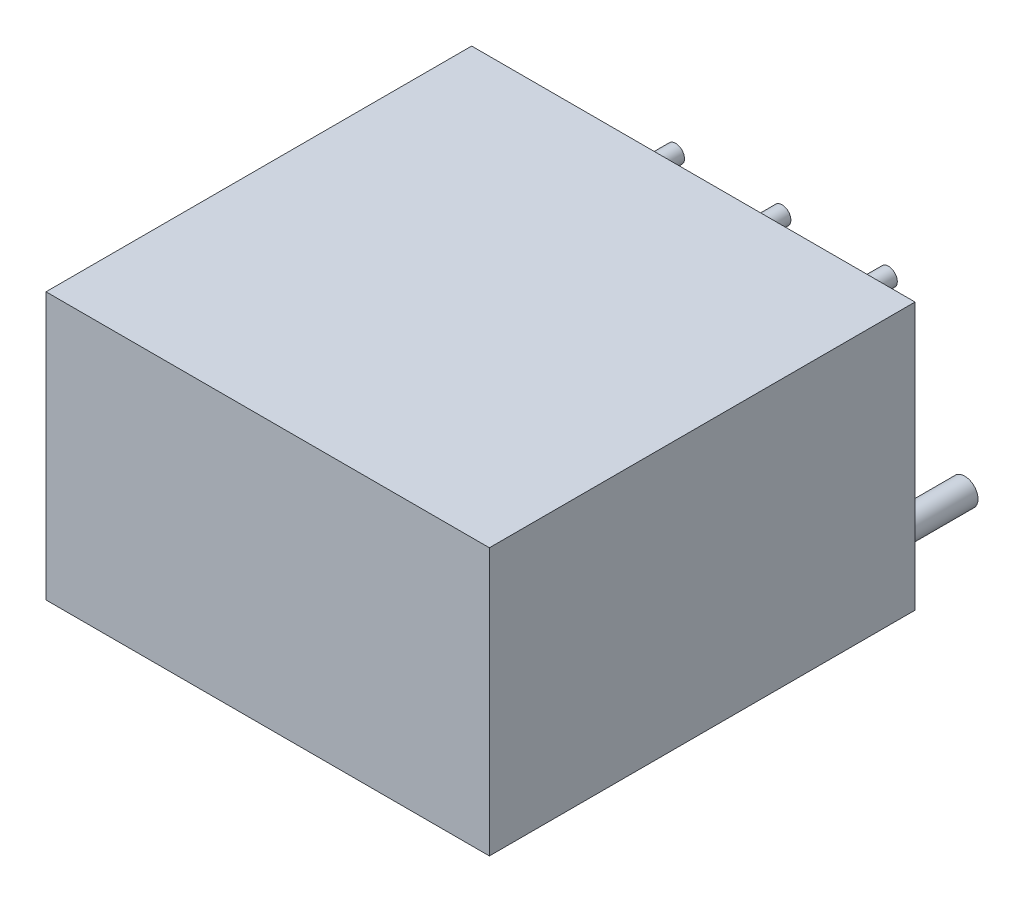
from build123d import *

# Parameters (mm, degrees)
SKETCH_2_W      = 25.0000008
SKETCH_2_H      = 15.04999784
EXTRUDE_2_DEPTH = 24
SKETCH_3_R      = 0.75
SKETCH_3_R_2    = 0.5
EXTRUDE_3_DEPTH = 5


with BuildPart() as part:
    # Эскиз2 → Бобышка-Вытянуть2 (new body)
    with BuildSketch(Plane.XY):
        with Locations((-17.07912528, 17.543231945)):
            Rectangle(SKETCH_2_W, SKETCH_2_H)
    extrude(amount=EXTRUDE_2_DEPTH)

    # Эскиз3 → Бобышка-Вытянуть3 (add)
    with BuildSketch(Plane(origin=(0, 0, 0), x_dir=(-1, 0, 0), z_dir=(0, 0, -1))):
        with Locations(Location((6.77912488, 12.218233025, 0), (0, 0, 180))):
            Circle(SKETCH_3_R)
        with Locations(Location((11.07912488, 14.568230865, 0), (0, 0, 180))):
            Circle(SKETCH_3_R_2)
        with Locations(Location((17.07912558, 14.568230865, 0), (0, 0, 180))):
            Circle(SKETCH_3_R_2)
        with Locations(Location((11.07912488, 20.568230865, 0), (0, 0, 180))):
            Circle(SKETCH_3_R_2)
        with Locations(Location((17.07912558, 20.568230865, 0), (0, 0, 180))):
            Circle(SKETCH_3_R_2)
        with Locations(Location((23.07912628, 20.568230865, 0), (0, 0, 180))):
            Circle(SKETCH_3_R_2)
        with Locations(Location((23.07912628, 14.568230865, 0), (0, 0, 180))):
            Circle(SKETCH_3_R_2)
        with Locations(Location((27.37912568, 12.218233025, 0), (0, 0, 180))):
            Circle(SKETCH_3_R)
    extrude(amount=EXTRUDE_3_DEPTH)


solid = part.part
